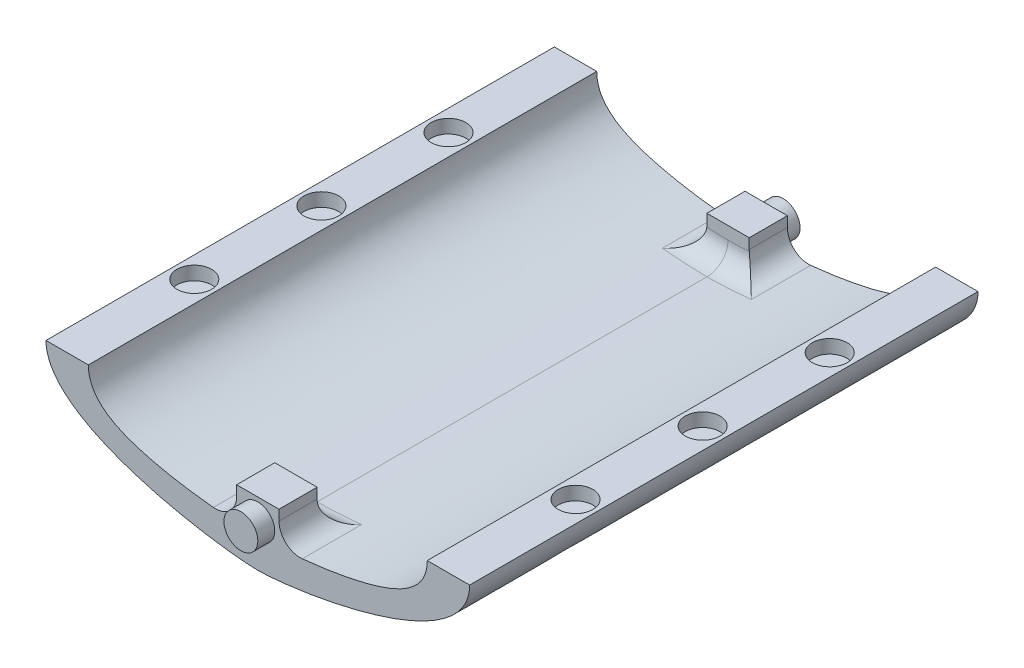
from build123d import *

# Parameters (mm, degrees)
BOSS_EXTRUDE3_DEPTH  = 120
SKETCH13_R           = 4.1
CUT_EXTRUDE3_DEPTH   = 3.2
SKETCH14_W           = 10
SKETCH14_H           = 10
BOSS_EXTRUDE4_DEPTH  = 9
SKETCH15_R           = 4
BOSS_EXTRUDE5_DEPTH  = 4
FILLET1_R            = 5
FILLET1_OF_MIRROR5_R = 5


with BuildPart() as part:
    # Sketch2<6> → Boss-Extrude3 (new body)
    with BuildSketch(Plane.XY):
        with BuildLine():
            Line((0, -12), (0, -5))
            add(Edge.make_bspline(
                [(0, -5), (3.588807168, -5), (23.336430055, -4.119862844), (40, 2.980550504), (40, 10)],
                knots=[0, 0, 0, 0, 0.567246619, 1, 1, 1, 1], degree=3))
            Line((40, 10), (50, 10))
            add(Edge.make_bspline(
                [(0, -12), (8.964506783, -12), (50, -6.090108399), (50, 10)],
                knots=[0, 0, 0, 0, 1, 1, 1, 1], degree=3))
        make_face()
    boss_extrude3 = extrude(amount=BOSS_EXTRUDE3_DEPTH)

    # Mirror3: Boss-Extrude3 across plane
    add(boss_extrude3.mirror(Plane(origin=(0, 0, 0), x_dir=(0, 0, 1), z_dir=(1, 0, 0))))

    # Sketch13 → Cut-Extrude3 (cut)
    with BuildSketch(Plane(origin=(0, 10, 0), x_dir=(1, 0, 0), z_dir=(0, 1, 0))):
        with Locations((-45, -30)):
            Circle(SKETCH13_R)
        with Locations((-45, -60)):
            Circle(SKETCH13_R)
        with Locations((-45, -90)):
            Circle(SKETCH13_R)
    cut_extrude3 = extrude(amount=-CUT_EXTRUDE3_DEPTH, mode=Mode.SUBTRACT)

    # Mirror4: Cut-Extrude3 across plane
    add(cut_extrude3.mirror(Plane(origin=(0, 0, 0), x_dir=(0, 0, 1), z_dir=(1, 0, 0))), mode=Mode.SUBTRACT)

    # Sketch14 → Boss-Extrude4 (add)
    with BuildSketch(Plane.XY.offset(120)):
        with Locations((0, -2)):
            Rectangle(SKETCH14_W, SKETCH14_H)
    boss_extrude4 = extrude(amount=-BOSS_EXTRUDE4_DEPTH)

    # Sketch15 → Boss-Extrude5 (add)
    with BuildSketch(Plane.XY.offset(120)):
        with Locations((0, -2)):
            Circle(SKETCH15_R)
    boss_extrude5 = extrude(amount=BOSS_EXTRUDE5_DEPTH)

    # Fillet1
    fillet1_edges = [part.edges().sort_by_distance(p)[0] for p in [
        (-2.501115248, -4.947412241, 111),
        (5, -4.827755806, 115.5),
        (2.501115248, -4.947412241, 111),
        (-5, -4.827755806, 115.5),
    ]]
    fillet(fillet1_edges, radius=FILLET1_R)

    # Mirror5: Boss-Extrude4, Boss-Extrude5 across plane
    add(boss_extrude4.mirror(Plane(origin=(0, 0, 60), x_dir=(1, 0, 0), z_dir=(0, 0, -1))))
    add(boss_extrude5.mirror(Plane(origin=(0, 0, 60), x_dir=(1, 0, 0), z_dir=(0, 0, -1))))

    # Fillet1 of Mirror5
    fillet1_of_mirror5_edges = [part.edges().sort_by_distance(p)[0] for p in [
        (-2.501115248, -4.947412241, 9),
        (5, -4.827755806, 4.5),
        (2.501115248, -4.947412241, 9),
        (-5, -4.827755806, 4.5),
    ]]
    fillet(fillet1_of_mirror5_edges, radius=FILLET1_OF_MIRROR5_R)


solid = part.part
